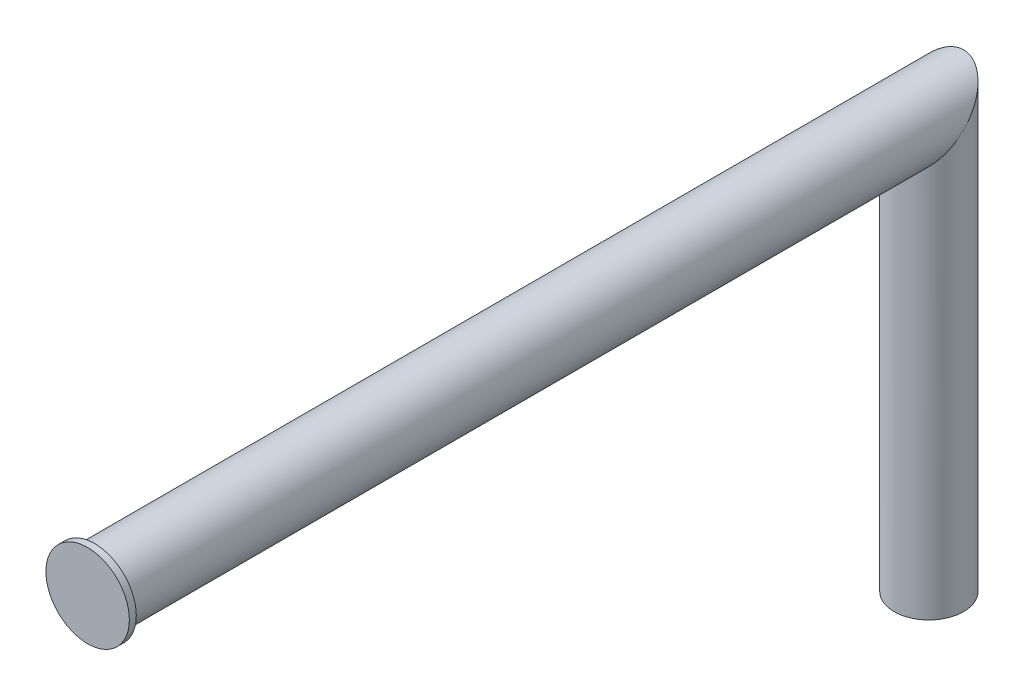
from build123d import *

# Parameters (mm, degrees)
SKETCH2_R           = 12.7
SKETCH6_R           = 15.24
BOSS_EXTRUDE2_DEPTH = 25.4
SKETCH7_R           = 15.24
CUT_EXTRUDE1_DEPTH  = 22.86


with BuildPart() as part:
    # Sweep1: sweep along a path in Sketch1
    with BuildLine(Plane(origin=(0, 0, 0), x_dir=(0, 0, -1), z_dir=(1, 0, 0))) as sweep1_path:
        Line((0, 0), (330.2, 0))
        Line((330.2, 0), (330.2, -152.4))
    # Sketch2 → Sweep1 (sweep)
    with BuildSketch(Plane.XY):
        Circle(SKETCH2_R)
    sweep(path=sweep1_path.line, transition=Transition.RIGHT)

    # Sketch6 → Boss-Extrude2 (add)
    with BuildSketch(Plane.XY):
        Circle(SKETCH6_R)
    extrude(amount=-BOSS_EXTRUDE2_DEPTH)

    # Sketch7 → Cut-Extrude1 (cut)
    with BuildSketch(Plane.XY):
        Circle(SKETCH7_R)
    extrude(amount=-CUT_EXTRUDE1_DEPTH, mode=Mode.SUBTRACT)


solid = part.part
